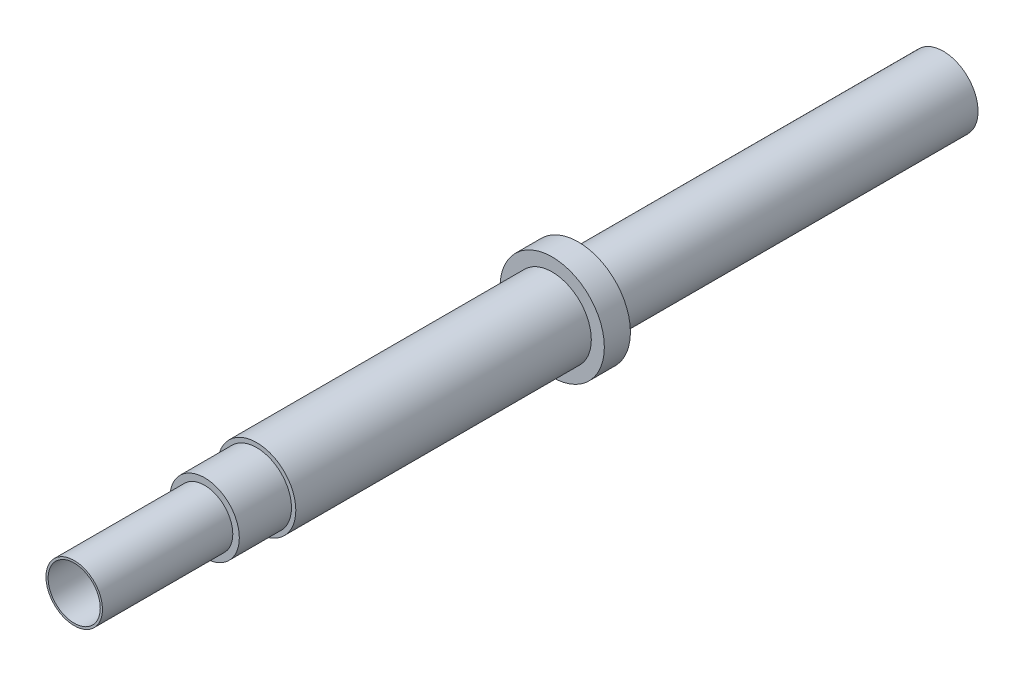
from build123d import *

# Parameters (mm, degrees)
SKETCH2_R           = 4
SKETCH2_R_2         = 3
BOSS_EXTRUDE1_DEPTH = 42
SKETCH3_R           = 6
SKETCH3_R_2         = 4
BOSS_EXTRUDE2_DEPTH = 3
SKETCH4_R           = 4.5
SKETCH4_R_2         = 4
BOSS_EXTRUDE3_DEPTH = 34
SKETCH5_R           = 4
SKETCH5_R_2         = 3
BOSS_EXTRUDE4_DEPTH = 6
SKETCH6_R           = 3.25
SKETCH6_R_2         = 3
BOSS_EXTRUDE5_DEPTH = 15


with BuildPart() as part:
    # Sketch2 → Boss-Extrude1 (new body)
    with BuildSketch(Plane.XY):
        with Locations(Location((0, 0, 0), (0, 0, 180))):
            Circle(SKETCH2_R)
        with Locations(Location((0, 0, 0), (0, 0, 180))):
            Circle(SKETCH2_R_2, mode=Mode.SUBTRACT)
    extrude(amount=BOSS_EXTRUDE1_DEPTH)


with BuildPart() as body_2:
    # Sketch3 → Boss-Extrude2 (new body)
    with BuildSketch(Plane.XY.offset(42)):
        Circle(SKETCH3_R)
        Circle(SKETCH3_R_2, mode=Mode.SUBTRACT)
    extrude(amount=BOSS_EXTRUDE2_DEPTH)

    # Sketch4 → Boss-Extrude3 (add)
    with BuildSketch(Plane.XY.offset(45)):
        Circle(SKETCH4_R)
        Circle(SKETCH4_R_2, mode=Mode.SUBTRACT)
    extrude(amount=BOSS_EXTRUDE3_DEPTH)


with BuildPart() as body_3:
    # Sketch5 → Boss-Extrude4 (new body)
    with BuildSketch(Plane.XY.offset(79)):
        Circle(SKETCH5_R)
        Circle(SKETCH5_R_2, mode=Mode.SUBTRACT)
    extrude(amount=BOSS_EXTRUDE4_DEPTH)

    # Sketch6 → Boss-Extrude5 (add)
    with BuildSketch(Plane.XY.offset(85)):
        Circle(SKETCH6_R)
        Circle(SKETCH6_R_2, mode=Mode.SUBTRACT)
    extrude(amount=BOSS_EXTRUDE5_DEPTH)


solid = Compound([part.part, body_2.part, body_3.part])
